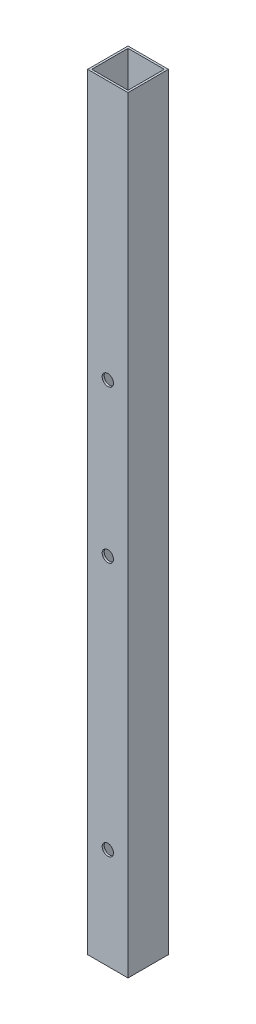
from build123d import *

# Parameters (mm, degrees)
SKETCH1_W           = 25.4
SKETCH1_H           = 25.4
BOSS_EXTRUDE1_DEPTH = 482.6
SKETCH3_R           = 2.54
CUT_EXTRUDE1_DEPTH  = 2.54
SKETCH4_R           = 2.54
CUT_EXTRUDE2_DEPTH  = 2.54
SKETCH5_R           = 2.54
CUT_EXTRUDE3_DEPTH  = 2.54
SKETCH6_R           = 3.556
CUT_EXTRUDE4_DEPTH  = 2.54
SKETCH7_R           = 3.556
CUT_EXTRUDE5_DEPTH  = 2.54


with BuildPart() as part:
    # Sketch1 → Boss-Extrude1 (new body)
    with BuildSketch(Plane(origin=(0, 0, 0), x_dir=(1, 0, 0), z_dir=(0, 1, 0))):
        with Locations((12.7, 12.7)):
            Rectangle(SKETCH1_W, SKETCH1_H)
        Polygon((1.27, 12.361459156), (1.27, 24.13), (12.7, 24.13), (24.13, 24.13), (24.13, 12.7), (24.13, 1.27), (12.7, 1.27), (1.27, 1.27), align=None, mode=Mode.SUBTRACT)
    extrude(amount=BOSS_EXTRUDE1_DEPTH)

    # Sketch3 → Cut-Extrude1 (cut)
    with BuildSketch(Plane(origin=(0, 0, -25.4), x_dir=(-1, 0, 0), z_dir=(0, 0, -1))):
        with Locations((-12.762028981, 449.168015032)):
            Circle(SKETCH3_R)
    extrude(amount=-CUT_EXTRUDE1_DEPTH, mode=Mode.SUBTRACT)

    # Sketch4 → Cut-Extrude2 (cut)
    with BuildSketch(Plane(origin=(0, 0, -25.4), x_dir=(-1, 0, 0), z_dir=(0, 0, -1))):
        with Locations((-12.70057371, 321.200750094)):
            Circle(SKETCH4_R)
    extrude(amount=-CUT_EXTRUDE2_DEPTH, mode=Mode.SUBTRACT)

    # Sketch5 → Cut-Extrude3 (cut)
    with BuildSketch(Plane(origin=(0, 0, -25.4), x_dir=(-1, 0, 0), z_dir=(0, 0, -1))):
        with Locations((-12.715968996, 18.41791766)):
            Circle(SKETCH5_R)
    extrude(amount=-CUT_EXTRUDE3_DEPTH, mode=Mode.SUBTRACT)

    # Sketch6 → Cut-Extrude4 (cut)
    with BuildSketch(Plane.XY):
        with Locations((12.7, 63.552)):
            Circle(SKETCH6_R)
    extrude(amount=-CUT_EXTRUDE4_DEPTH, mode=Mode.SUBTRACT)

    # Sketch7 → Cut-Extrude5 (cut)
    with BuildSketch(Plane.XY):
        with Locations((12.7, 223.6)):
            Circle(SKETCH7_R)
        with Locations((12.7, 319.6)):
            Circle(SKETCH7_R)
    extrude(amount=-CUT_EXTRUDE5_DEPTH, mode=Mode.SUBTRACT)


solid = part.part
